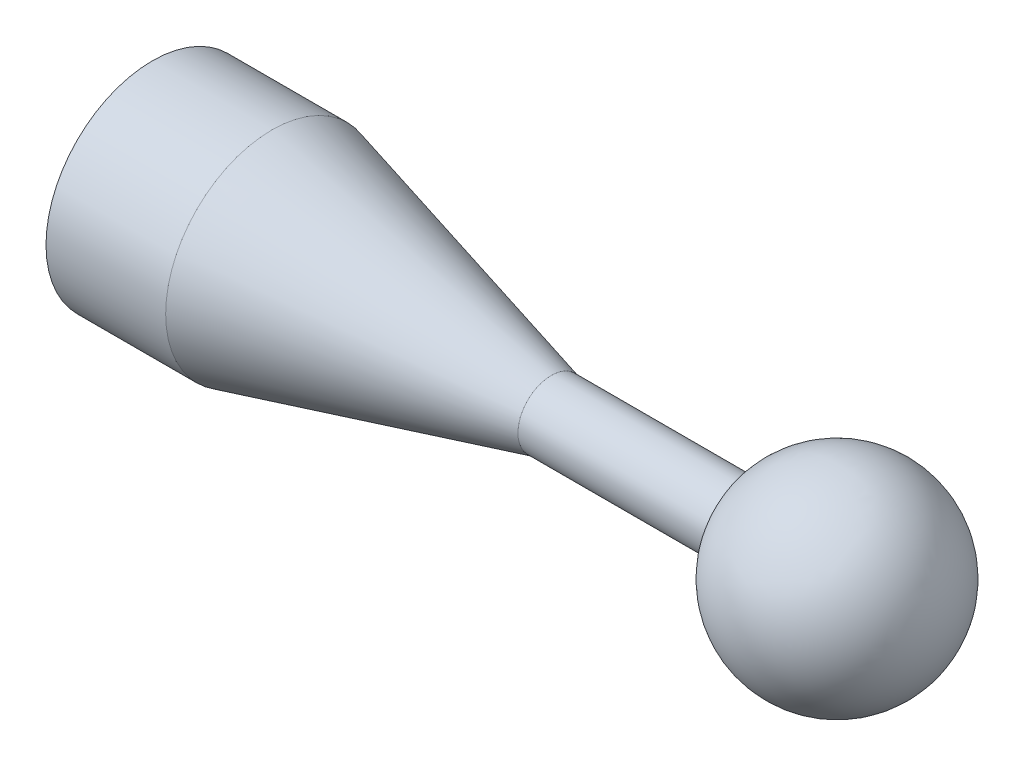
from build123d import *


with BuildPart() as part:
    # Esquisse1 → Révolution1 (revolve)
    with BuildSketch(Plane.XY, mode=Mode.PRIVATE) as r_volution1_sk:
        with BuildLine():
            Line((0, 0), (0, 16))
            Line((0, 16), (18, 16))
            Line((18, 16), (60, 5))
            Line((60, 5), (88.857864376, 5))
            ThreePointArc((88.857864376, 5), (105.536529681, 14.783978395), (118, 0))
            Line((118, 0), (0, 0))
        make_face()
    revolve(r_volution1_sk.sketch.rotate(Axis((-11.897715054, 0, 0), (1, 0, 0)), 90), axis=Axis((-11.897715054, 0, 0), (1, 0, 0)))


solid = part.part
